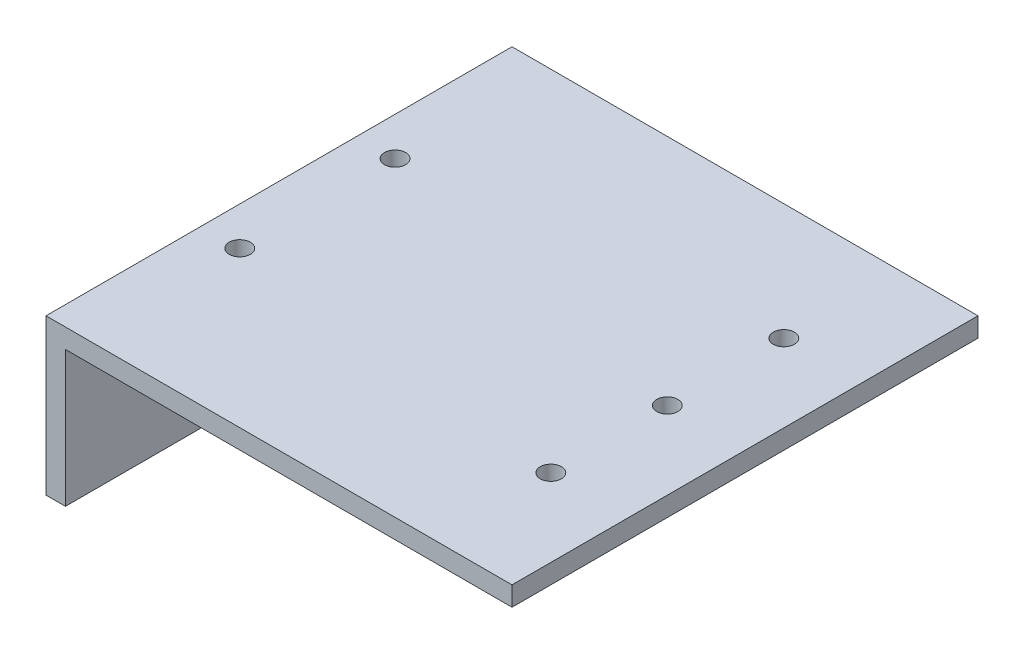
from build123d import *

# Parameters (mm, degrees)
BOSS_EXTRUDE1_DEPTH       = 76.2
TAP_DRILL_FOR_6_32_TAP1_D = 2.7051
TAP_DRILL_FOR_8_32_TAP1_D = 3.4544
CUT_EXTRUDE1_REACH        = 112.716
SKETCH8_W                 = 3.302
SKETCH8_H                 = 3.302
TAP_DRILL_FOR_8_32_TAP2_D = 3.4544


with BuildPart() as part:
    # Sketch2 → Boss-Extrude1 (new body)
    with BuildSketch(Plane.XY):
        Polygon((0, 0), (-76.2, 0), (-76.2, -25.4), (-73.025, -25.4), (-73.025, -3.175), (0, -3.175), align=None)
    extrude(amount=BOSS_EXTRUDE1_DEPTH)

    # Tap Drill for #6-32 Tap1 (through all)
    with Locations(Plane.ZY.offset(76.2)):
        with Locations((25.4, -15.24), (12.7, -15.24)):
            Hole(TAP_DRILL_FOR_6_32_TAP1_D / 2)

    # Tap Drill for #8-32 Tap1 (through all)
    with Locations(Plane(origin=(0, 0, 0), x_dir=(1, 0, 0), z_dir=(0, 1, 0))):
        with Locations((-69.917738612, -25.4), (-69.917738612, -50.8)):
            Hole(TAP_DRILL_FOR_8_32_TAP1_D / 2)

    # Sketch8 → Cut-Extrude1 (cut, up to next)
    with BuildSketch(Plane.ZY.offset(76.2), mode=Mode.PRIVATE) as cut_extrude1_sk1:
        with Locations((38.1, -15.24)):
            Rectangle(SKETCH8_W, SKETCH8_H)
    cut_extrude1_tool1 = extrude(cut_extrude1_sk1.sketch, amount=-CUT_EXTRUDE1_REACH, mode=Mode.PRIVATE) & part.part
    add(cut_extrude1_tool1.solids().sort_by_distance((-76.2, -15.24, 38.1))[0], mode=Mode.SUBTRACT)

    # Tap Drill for #8-32 Tap2 (through all)
    with Locations(Plane(origin=(0, 0, 0), x_dir=(1, 0, 0), z_dir=(0, 1, 0))):
        with Locations((-12.7, -19.05), (-12.7, -38.1), (-12.7, -57.15)):
            Hole(TAP_DRILL_FOR_8_32_TAP2_D / 2)


solid = part.part
